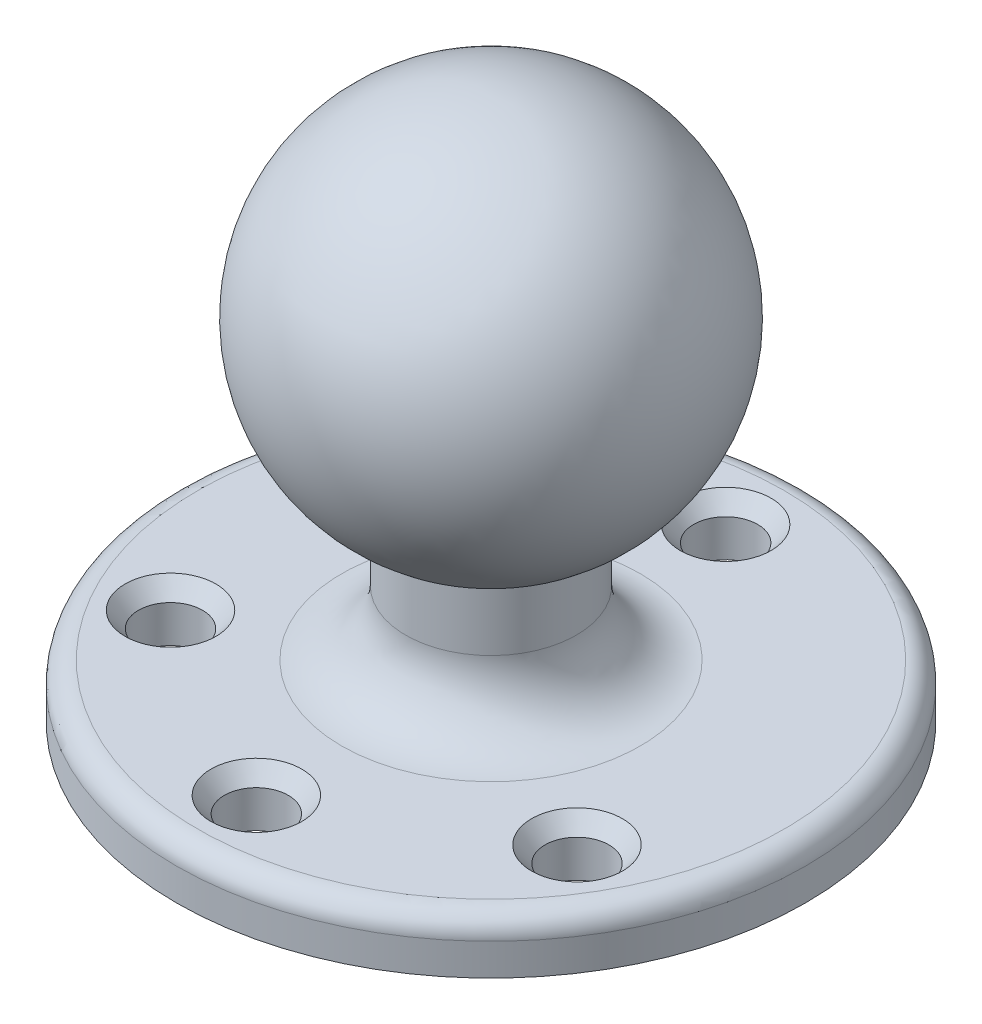
from build123d import *

# Parameters (mm, degrees)
SKETCH3_R          = 4.7625
CUT_EXTRUDE1_DEPTH = 10
CHAMFER1_SIZE      = 2
CHAMFER1_SIZE2     = 2.383507185


with BuildPart() as part:
    # Sketch1 → Revolve1 (revolve)
    with BuildSketch(Plane(origin=(0, 0, 0), x_dir=(0, 0, -1), z_dir=(1, 0, 0))):
        with BuildLine():
            Line((0, 0), (46.8249, 0))
            Line((46.8249, 0), (46.8249, 4.7498))
            ThreePointArc((46.8249, 4.7498), (45.89496403, 6.99486403), (43.6499, 7.9248))
            Line((43.6499, 7.9248), (22.225, 7.9248))
            ThreePointArc((22.225, 7.9248), (15.489807909, 10.714607909), (12.7, 17.4498))
            Line((12.7, 17.4498), (12.7, 26.472331649))
            ThreePointArc((12.7, 26.472331649), (27.820711692, 58.592164207), (0, 80.645))
            Line((0, 80.645), (0, 0))
        make_face()
    revolve(axis=Axis((0, 0, 0), (0, 1, 0)))

    # Sketch3 → Cut-Extrude1 (cut)
    with BuildSketch(Plane.XZ):
        with Locations(Location((-30.2514, 17.4498, 0), (0, 0, 270))):
            Circle(SKETCH3_R)
        with Locations(Location((30.2514, 17.4498, 0), (0, 0, 270))):
            Circle(SKETCH3_R)
        with Locations(Location((0, -34.925, 0), (0, 0, 270))):
            Circle(SKETCH3_R)
        with Locations(Location((0, 34.925, 0), (0, 0, 270))):
            Circle(SKETCH3_R)
    extrude(amount=-CUT_EXTRUDE1_DEPTH, mode=Mode.SUBTRACT)

    # Chamfer1
    chamfer1_edges = [part.edges().sort_by_distance(p)[0] for p in [
        (-30.2514, 7.9248, 22.2123),
        (30.2514, 7.9248, 22.2123),
        (0, 7.9248, -30.1625),
        (0, 7.9248, 39.6875),
    ]]
    chamfer1_side = [part.faces().sort_by_distance(p)[0] for p in [
        (0, 7.9248, 42.415294388),
    ]]
    chamfer(chamfer1_edges, length=CHAMFER1_SIZE, length2=CHAMFER1_SIZE2, reference=chamfer1_side[0])


solid = part.part
